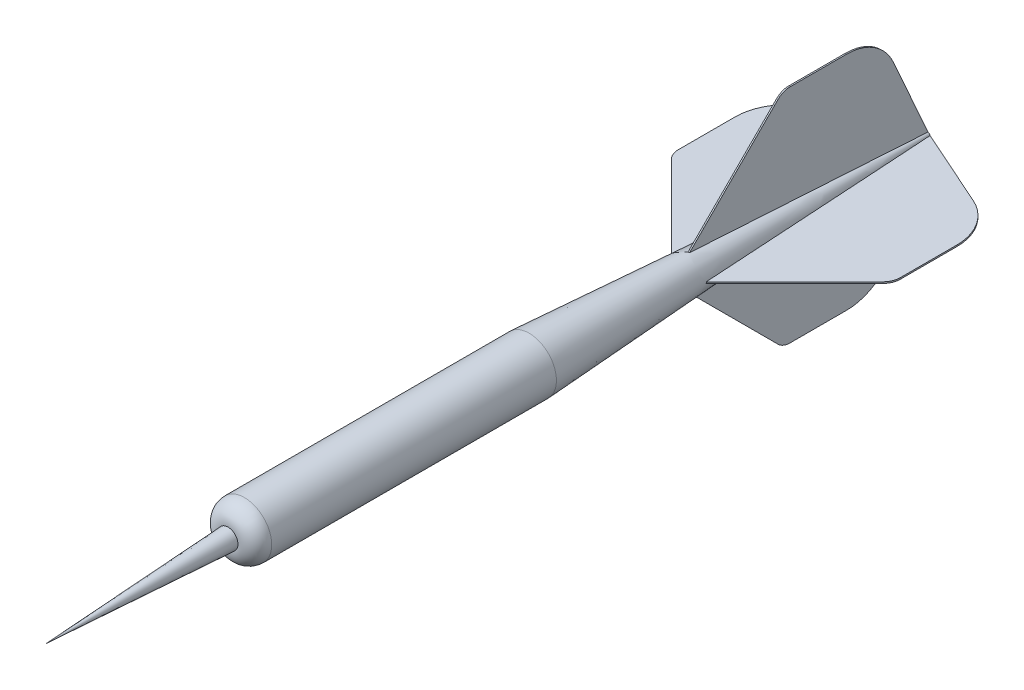
from build123d import *

# Parameters (mm, degrees)
FLIGHT_DEPTH  = 0.125
FLIGHTS_COUNT = 4


with BuildPart() as part:
    # Sketch1 → Dart (revolve)
    with BuildSketch(Plane(origin=(0, 0, 0), x_dir=(0, 0, -1), z_dir=(1, 0, 0))):
        with BuildLine():
            Line((0, 0), (-32, 0))
            Line((-32, 0), (0, 1.75))
            ThreePointArc((0, 1.75), (0.787661698, 3.896312185), (2.887760572, 4.8))
            Line((2.887760572, 4.8), (52.94, 4.8))
            Line((52.94, 4.8), (122.94, 0.5))
            Line((122.94, 0.5), (122.94, 0))
            Line((122.94, 0), (0, 0))
        make_face()
    revolve(axis=Axis((0, 0, -122.94), (0, 0, 1)))

    # Sketch3 → Flight (add, symmetric)
    with BuildSketch(Plane(origin=(0, 0, 0), x_dir=(0, 0, -1), z_dir=(1, 0, 0))):
        with BuildLine():
            Line((77.94, 0), (96.561320344, 18.621320344))
            ThreePointArc((96.561320344, 18.621320344), (97.53459039, 19.271638598), (98.682640687, 19.5))
            Line((98.682640687, 19.5), (108.63598664, 19.5))
            ThreePointArc((108.63598664, 19.5), (113.537737955, 18.048035112), (116.857895759, 14.160629788))
            Line((116.857895759, 14.160629788), (122.94, 0.5))
            Line((122.94, 0.5), (122.94, 0))
            Line((122.94, 0), (77.94, 0))
        make_face()
    flight = extrude(amount=FLIGHT_DEPTH, both=True)

    # Flights: Flight ×4 about axis
    flights_axis = Axis((0, 0, 0), (0, 0, 1))
    for i in range(1, FLIGHTS_COUNT):
        add(flight.rotate(flights_axis, i * 360 / FLIGHTS_COUNT))


solid = part.part
